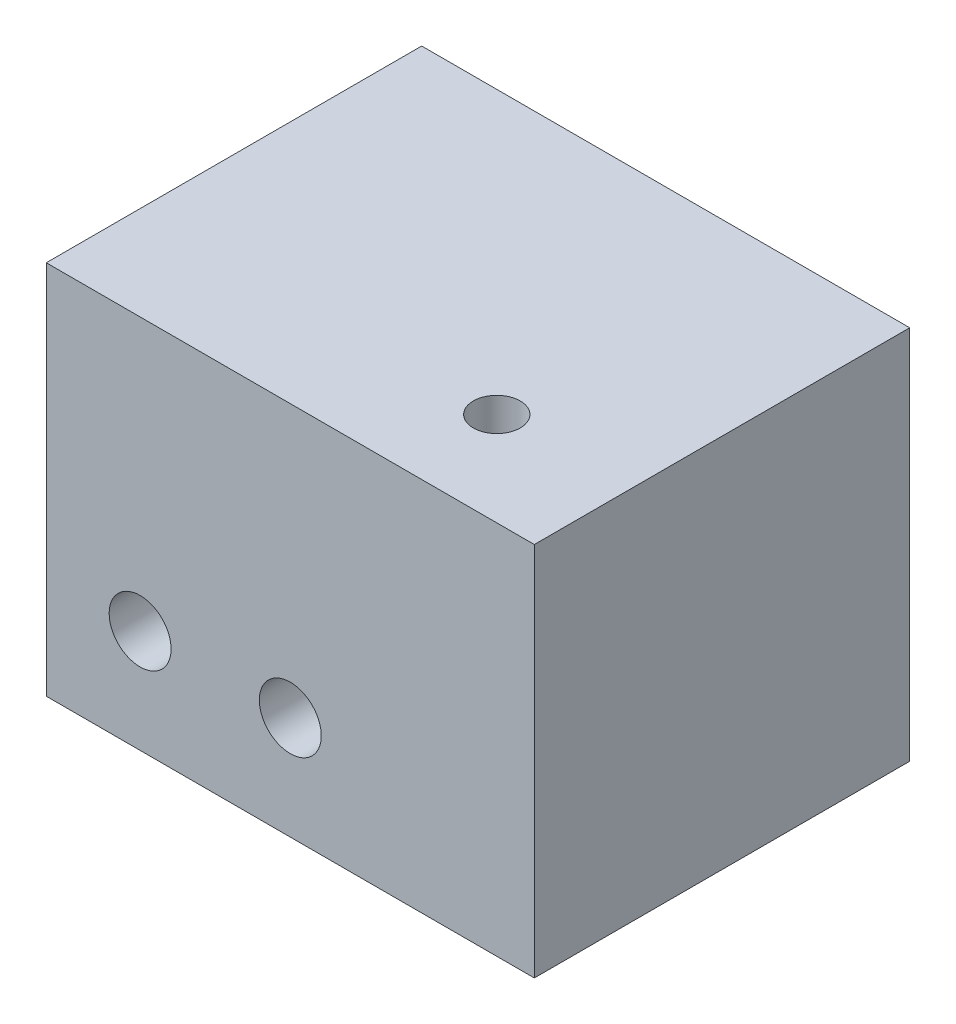
from build123d import *

# Parameters (mm, degrees)
SKETCH_1_W          = 26
SKETCH_1_H          = 20
EXTRUDE_1_DEPTH     = 25
CUT_EXTRUDE_1_DEPTH = 16
FILLET_1_R          = 2
SKETCH_3_R          = 1.25
CUT_EXTRUDE_2_DEPTH = 23.912878475
SKETCH_4_R          = 1.65
CUT_EXTRUDE_3_DEPTH = 35.554305086
SKETCH_5_W          = 20
SKETCH_5_H          = 5
CUT_EXTRUDE_4_DEPTH = 38.429934544


with BuildPart() as part:
    # 草图1 → 凸台-拉伸1 (new body)
    with BuildSketch(Plane(origin=(0, 0, 0), x_dir=(1, 0, 0), z_dir=(0, 1, 0))):
        Rectangle(SKETCH_1_W, SKETCH_1_H)
    extrude(amount=EXTRUDE_1_DEPTH)

    # 草图2 → 切除-拉伸1 (cut)
    with BuildSketch(Plane.XZ):
        with BuildLine():
            Line((5, 2.06571985), (5, -10))
            Line((5, -10), (7, -10))
            Line((7, -10), (7, 2.06571985))
            ThreePointArc((7, 2.06571985), (6, 8.1), (5, 2.06571985))
        make_face()
    extrude(amount=-CUT_EXTRUDE_1_DEPTH, mode=Mode.SUBTRACT)

    # 圆角1
    fillet_1_edges = [part.edges().sort_by_distance(p)[0] for p in [
        (5, 8, 2.06571985),
        (7, 8, 2.06571985),
    ]]
    fillet(fillet_1_edges, radius=FILLET_1_R)

    # 草图3 → 切除-拉伸2 (cut, through all)
    with BuildSketch(Plane.XZ.offset(-16)):
        with Locations(Location((6, 5, 0), (0, 0, 270))):
            Circle(SKETCH_3_R)
    extrude(amount=-CUT_EXTRUDE_2_DEPTH, mode=Mode.SUBTRACT)

    # 草图4 → 切除-拉伸3 (cut, through all)
    with BuildSketch(Plane(origin=(0, 0, -10), x_dir=(-1, 0, 0), z_dir=(0, 0, -1))):
        with Locations((8, 10.5)):
            Circle(SKETCH_4_R)
        with Locations((0, 10.5)):
            Circle(SKETCH_4_R)
    extrude(amount=-CUT_EXTRUDE_3_DEPTH, mode=Mode.SUBTRACT)

    # 草图5 → 切除-拉伸4 (cut, through all)
    with BuildSketch(Plane(origin=(13, 0, 0), x_dir=(0, 0, -1), z_dir=(1, 0, 0))):
        with Locations((0, 2.5)):
            Rectangle(SKETCH_5_W, SKETCH_5_H)
    extrude(amount=-CUT_EXTRUDE_4_DEPTH, mode=Mode.SUBTRACT)


solid = part.part
